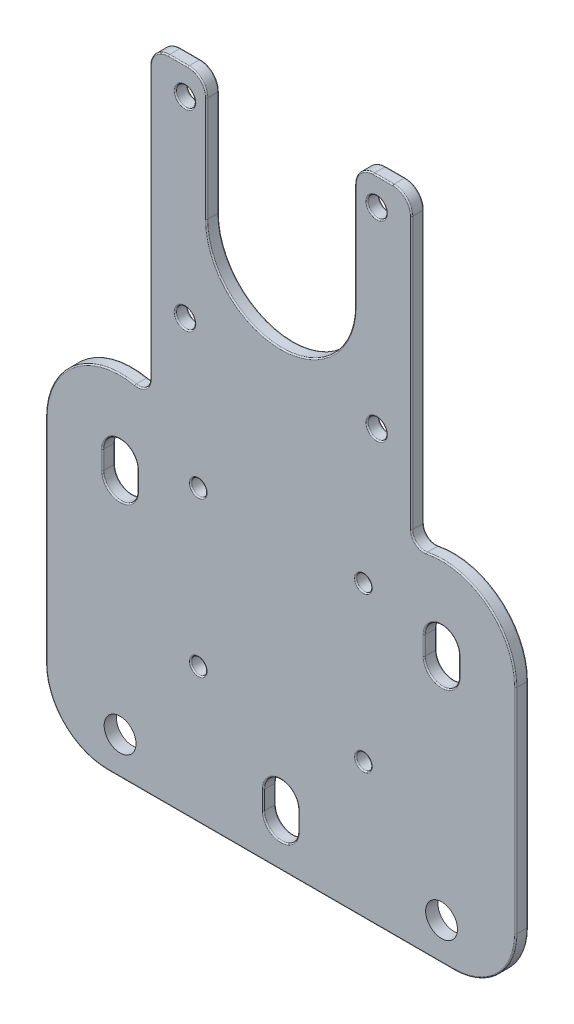
from build123d import *

# Parameters (mm, degrees)
SKETCH_1_R          = 1.55
EXTRUDE_2_DEPTH     = 2
SKETCH_3_R          = 1.25
CUT_EXTRUDE_1_DEPTH = 71.728300832
FILLET_1_R          = 10
FILLET_2_R          = 0.2
SKETCH_4_R          = 2.575
CUT_EXTRUDE_2_DEPTH = 10


with BuildPart() as part:
    # 草图1 → 凸台-拉伸2 (new body)
    with BuildSketch(Plane.XY):
        with BuildLine():
            Line((-12, 39.619565065), (-12, 56.619565065))
            ThreePointArc((-12, 56.619565065), (-12.878679656, 58.740885409), (-15, 59.619565065))
            Line((-15, 59.619565065), (-18.15, 59.619565065))
            ThreePointArc((-18.15, 59.619565065), (-20.271320344, 58.740885409), (-21.15, 56.619565065))
            Line((-21.15, 56.619565065), (-21.15, 12.726406423))
            ThreePointArc((-21.15, 12.726406423), (-21.887915556, 11.17490945), (-23.557142857, 10.768286229))
            ThreePointArc((-23.557142857, 10.768286229), (-33.572506662, 8.328546903), (-38, -0.980434935))
            Line((-38, -0.980434935), (-38, -45.480434935))
            Line((-38, -45.480434935), (38, -45.480434935))
            Line((38, -45.480434935), (38, -0.980434935))
            ThreePointArc((38, -0.980434935), (33.572506662, 8.328546903), (23.557142857, 10.768286229))
            ThreePointArc((23.557142857, 10.768286229), (21.887915556, 11.17490945), (21.15, 12.726406423))
            Line((21.15, 12.726406423), (21.15, 56.619565065))
            ThreePointArc((21.15, 56.619565065), (20.271320344, 58.740885409), (18.15, 59.619565065))
            Line((18.15, 59.619565065), (15, 59.619565065))
            ThreePointArc((15, 59.619565065), (12.878679656, 58.740885409), (12, 56.619565065))
            Line((12, 56.619565065), (12, 39.619565065))
            ThreePointArc((12, 39.619565065), (0, 27.619565065), (-12, 39.619565065))
        make_face()
        with Locations((-15.5, 55.119565065)):
            Circle(SKETCH_1_R, mode=Mode.SUBTRACT)
        with Locations((15.5, 24.119565065)):
            Circle(SKETCH_1_R, mode=Mode.SUBTRACT)
        with Locations((-15.5, 24.119565065)):
            Circle(SKETCH_1_R, mode=Mode.SUBTRACT)
        with Locations((15.5, 55.119565065)):
            Circle(SKETCH_1_R, mode=Mode.SUBTRACT)
        with BuildLine():
            ThreePointArc((2.8, -35.630434935), (0, -32.830434935), (-2.8, -35.630434935))
            Line((-2.8, -35.630434935), (-2.8, -38.630434935))
            ThreePointArc((-2.8, -38.630434935), (0, -41.430434935), (2.8, -38.630434935))
            Line((2.8, -38.630434935), (2.8, -35.630434935))
        make_face(mode=Mode.SUBTRACT)
        with BuildLine():
            ThreePointArc((-28.8, -3.980434935), (-26, -6.780434935), (-23.2, -3.980434935))
            Line((-23.2, -3.980434935), (-23.2, -0.980434935))
            ThreePointArc((-23.2, -0.980434935), (-26, 1.819565065), (-28.8, -0.980434935))
            Line((-28.8, -0.980434935), (-28.8, -3.980434935))
        make_face(mode=Mode.SUBTRACT)
        with BuildLine():
            Line((28.8, -0.980434935), (28.8, -3.980434935))
            ThreePointArc((28.8, -3.980434935), (26, -6.780434935), (23.2, -3.980434935))
            Line((23.2, -3.980434935), (23.2, -0.980434935))
            ThreePointArc((23.2, -0.980434935), (26, 1.819565065), (28.8, -0.980434935))
        make_face(mode=Mode.SUBTRACT)
    extrude(amount=EXTRUDE_2_DEPTH)

    # 草图3 → 切除-拉伸1 (cut, through all)
    with BuildSketch(Plane.XY.offset(2)):
        with Locations((13.35, 1.399565065)):
            Circle(SKETCH_3_R)
        with Locations((13.35, -23.600434935)):
            Circle(SKETCH_3_R)
        with Locations(Location((-13.35, -23.600434935, 0), (0, 0, 180))):
            Circle(SKETCH_3_R)
        with Locations(Location((-13.35, 1.399565065, 0), (0, 0, 180))):
            Circle(SKETCH_3_R)
    extrude(amount=-CUT_EXTRUDE_1_DEPTH, mode=Mode.SUBTRACT)

    # 圆角1
    fillet_1_edges = [part.edges().sort_by_distance(p)[0] for p in [
        (38, -45.480434935, 1),
        (-38, -45.480434935, 1),
    ]]
    fillet(fillet_1_edges, radius=FILLET_1_R)

    # 圆角2
    fillet_2_edges = [part.edges().sort_by_distance(p)[0] for p in [
        (-17.05, 55.119565065, 2),
        (13.95, 24.119565065, 2),
        (-17.05, 24.119565065, 2),
        (13.95, 55.119565065, 2),
        (-12, 48.119565065, 2),
        (-12.1, 1.399565065, 0),
        (-12.1, 1.399565065, 2),
        (-12.1, -23.600434935, 0),
        (-12.1, -23.600434935, 2),
        (-12.878679656, 58.740885409, 2),
        (12.1, -23.600434935, 0),
        (12.1, -23.600434935, 2),
        (12.1, 1.399565065, 0),
        (12.1, 1.399565065, 2),
        (0, -32.830434935, 2),
        (-16.575, 59.619565065, 2),
        (-20.271320344, 58.740885409, 2),
        (0, -45.480434935, 0),
        (-35.071067812, -42.551502747, 0),
        (35.071067812, -42.551502747, 0),
        (0, -45.480434935, 2),
        (-35.071067812, -42.551502747, 2),
        (35.071067812, -42.551502747, 2),
        (-21.15, 34.672985744, 2),
        (-21.887915556, 11.17490945, 2),
        (-33.572506662, 8.328546903, 2),
        (-38, -18.230434935, 2),
        (38, -18.230434935, 2),
        (33.572506662, 8.328546903, 2),
        (21.887915556, 11.17490945, 2),
        (2.8, -37.130434935, 2),
        (21.15, 34.672985744, 2),
        (20.271320344, 58.740885409, 2),
        (16.575, 59.619565065, 2),
        (12.878679656, 58.740885409, 2),
        (12, 48.119565065, 2),
        (0, 27.619565065, 2),
        (0, -41.430434935, 2),
        (-2.8, -37.130434935, 2),
        (0, 27.619565065, 0),
        (12, 48.119565065, 0),
        (12.878679656, 58.740885409, 0),
        (16.575, 59.619565065, 0),
        (20.271320344, 58.740885409, 0),
        (21.15, 34.672985744, 0),
        (21.887915556, 11.17490945, 0),
        (33.572506662, 8.328546903, 0),
        (38, -18.230434935, 0),
        (-38, -18.230434935, 0),
        (-33.572506662, 8.328546903, 0),
        (-21.887915556, 11.17490945, 0),
        (-26, -6.780434935, 2),
        (-21.15, 34.672985744, 0),
        (-20.271320344, 58.740885409, 0),
        (-16.575, 59.619565065, 0),
        (-12.878679656, 58.740885409, 0),
        (-12, 48.119565065, 0),
        (13.95, 55.119565065, 0),
        (-17.05, 24.119565065, 0),
        (13.95, 24.119565065, 0),
        (-17.05, 55.119565065, 0),
        (26, 1.819565065, 0),
        (-28.8, -2.480434935, 2),
        (23.2, -2.480434935, 0),
        (26, -6.780434935, 0),
        (28.8, -2.480434935, 0),
        (-23.2, -2.480434935, 0),
        (-26, 1.819565065, 0),
        (-28.8, -2.480434935, 0),
        (-26, -6.780434935, 0),
        (-2.8, -37.130434935, 0),
        (0, -41.430434935, 0),
        (2.8, -37.130434935, 0),
        (0, -32.830434935, 0),
        (-26, 1.819565065, 2),
        (-23.2, -2.480434935, 2),
        (28.8, -2.480434935, 2),
        (26, -6.780434935, 2),
        (23.2, -2.480434935, 2),
        (26, 1.819565065, 2),
    ]]
    fillet(fillet_2_edges, radius=FILLET_2_R)

    # 草图4 → 切除-拉伸2 (cut)
    with BuildSketch(Plane.XY.offset(2)):
        with Locations((26, -39.480434935)):
            Circle(SKETCH_4_R)
        with Locations((-26, -39.480434935)):
            Circle(SKETCH_4_R)
    extrude(amount=-CUT_EXTRUDE_2_DEPTH, mode=Mode.SUBTRACT)


solid = part.part
